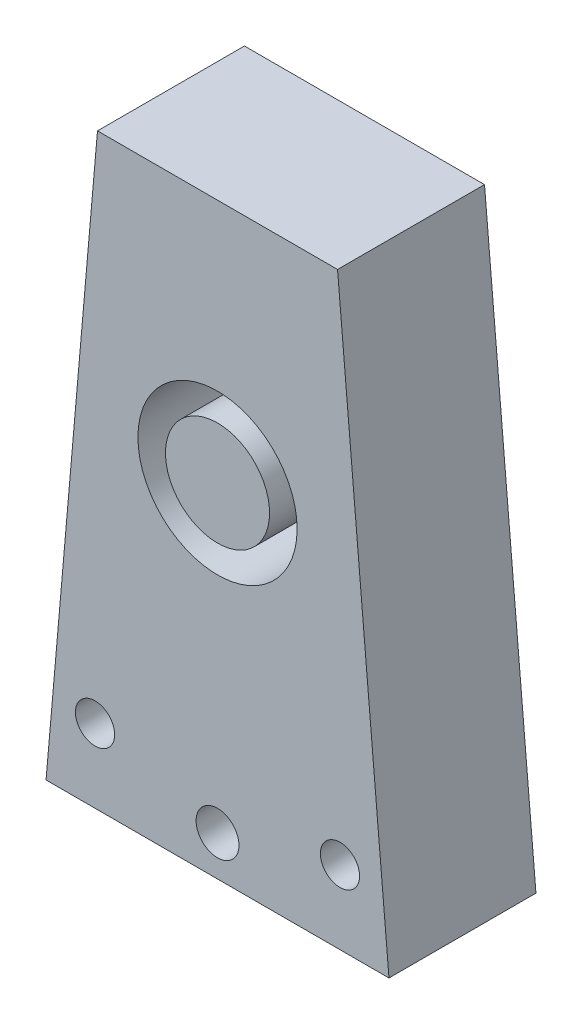
from build123d import *

# Parameters (mm, degrees)
BOSS_EXTRUDE1_DEPTH = 12
SKETCH2_R           = 1.6
SKETCH2_R_2         = 1.75
SKETCH2_R_3         = 6.5
SKETCH2_R_4         = 4.25
CUT_EXTRUDE2_DEPTH  = 13


with BuildPart() as part:
    # Sketch1 → Boss-Extrude1 (new body)
    with BuildSketch(Plane.XY):
        Polygon((-14, 0), (14, 0), (9.8, 48), (-9.8, 48), align=None)
    extrude(amount=BOSS_EXTRUDE1_DEPTH)

    # Sketch2 → Cut-Extrude2 (cut)
    # profile 1 of 5: a face of its own
    with BuildSketch(Plane.XY):
        with Locations((10, 6)):
            Circle(SKETCH2_R)
    # profile 2 of 5: a face of its own
    with BuildSketch(Plane.XY):
        with Locations((-10, 6)):
            Circle(SKETCH2_R)
    # profile 3 of 5: a face of its own
    with BuildSketch(Plane.XY):
        with Locations((0, 52.75)):
            Circle(SKETCH2_R_2)
    # profile 4 of 5: a face of its own
    with BuildSketch(Plane.XY):
        with Locations((0, 3.25)):
            Circle(SKETCH2_R_2)
    # profile 5 of 5: a face of its own
    with BuildSketch(Plane.XY):
        with Locations((0, 28)):
            Circle(SKETCH2_R_3)
        with Locations((0, 28)):
            Circle(SKETCH2_R_4, mode=Mode.SUBTRACT)
    extrude(amount=CUT_EXTRUDE2_DEPTH, mode=Mode.SUBTRACT)


with BuildPart() as cut_extrude2_piece_1:
    # of the separate pieces the step leaves, piece 1, a body of its own (cut_extrude2_pieces)
    add(part.part.solids().sort_by_distance((-14, 0, 0))[0])


with BuildPart() as cut_extrude2_piece_2:
    # of the separate pieces the step leaves, piece 2, a body of its own (cut_extrude2_pieces)
    add(part.part.solids().sort_by_distance((4.25, 28, 0))[0])


solid = Compound([cut_extrude2_piece_1.part, cut_extrude2_piece_2.part])
